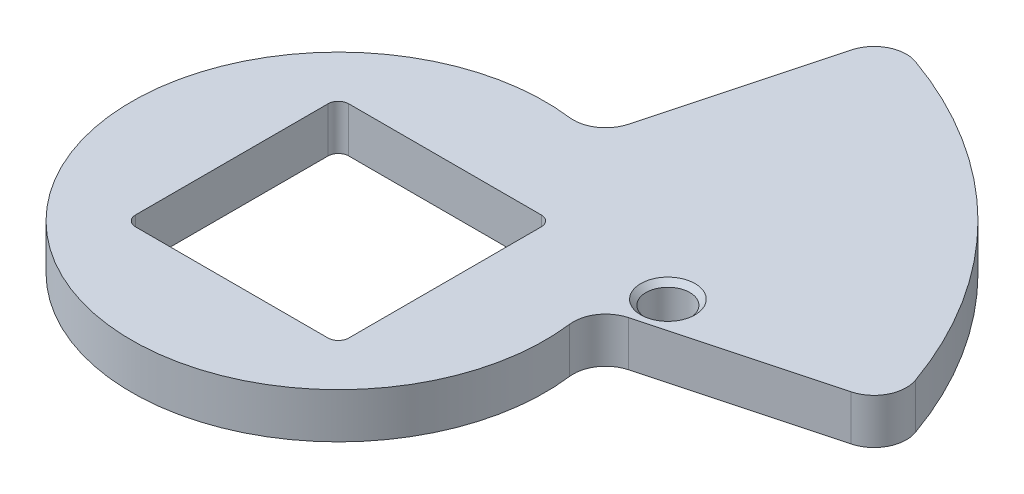
from build123d import *

# Parameters (mm, degrees)
SKETCH1_R           = 2.159
SKETCH1_W           = 20.955
SKETCH1_H           = 20.955
BOSS_EXTRUDE1_DEPTH = 4.445
FILLET1_R           = 3.175
FILLET2_R           = 1.016
CHAMFER1_SIZE       = 0.508


with BuildPart() as part:
    # Sketch1 → Boss-Extrude1 (new body)
    with BuildSketch(Plane(origin=(0, 0, 0), x_dir=(1, 0, 0), z_dir=(0, 1, 0))):
        with BuildLine():
            Line((42.935402979, 11.504506555), (19.62761279, 5.259202996))
            ThreePointArc((19.62761279, 5.259202996), (-14.368409794, -14.368409794), (5.259202996, 19.62761279))
            Line((5.259202996, 19.62761279), (11.504506555, 42.935402979))
            ThreePointArc((11.504506555, 42.935402979), (31.430896424, 31.430896424), (42.935402979, 11.504506555))
        make_face()
        with Locations(Location((22.86, 9.525, 0), (0, 0, 270))):
            Circle(SKETCH1_R, mode=Mode.SUBTRACT)
        Rectangle(SKETCH1_W, SKETCH1_H, mode=Mode.SUBTRACT)
    extrude(amount=BOSS_EXTRUDE1_DEPTH)

    # Fillet1
    fillet1_edges = [part.edges().sort_by_distance(p)[0] for p in [
        (42.935402979, 2.2225, -11.504506555),
        (19.62761279, 2.2225, -5.259202996),
        (5.259202996, 2.2225, -19.62761279),
        (11.504506555, 2.2225, -42.935402979),
    ]]
    fillet(fillet1_edges, radius=FILLET1_R)

    # Fillet2
    fillet2_edges = [part.edges().sort_by_distance(p)[0] for p in [
        (10.4775, 2.2225, 10.4775),
        (10.4775, 2.2225, -10.4775),
        (-10.4775, 2.2225, -10.4775),
        (-10.4775, 2.2225, 10.4775),
    ]]
    fillet(fillet2_edges, radius=FILLET2_R)

    # Chamfer1
    chamfer1_edges = [part.edges().sort_by_distance(p)[0] for p in [
        (22.86, 0, -11.684),
        (22.86, 4.445, -11.684),
    ]]
    chamfer(chamfer1_edges, length=CHAMFER1_SIZE)


solid = part.part
